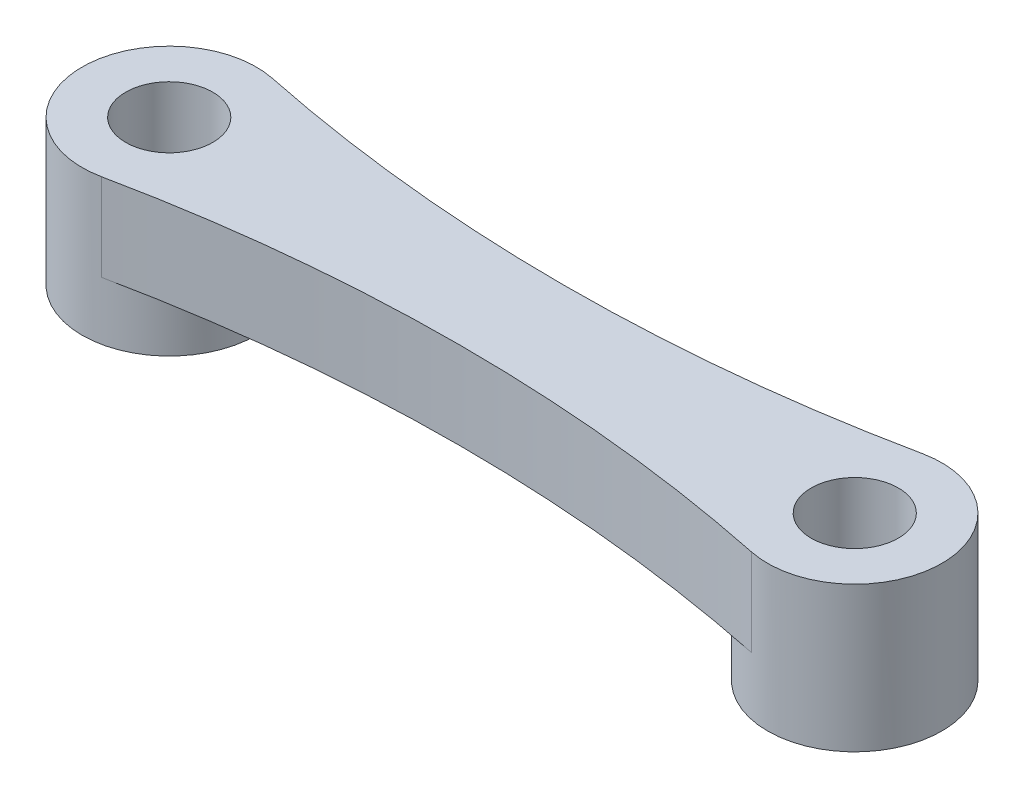
from build123d import *
from build123d.topology import SkipClean

# Parameters (mm, degrees)
SKETCH1_R           = 1.5
BOSS_EXTRUDE1_DEPTH = 3
SKETCH2_OUTSIDE_W   = 37.67
SKETCH2_OUTSIDE_H   = 14.07
CUT_EXTRUDE1_DEPTH  = 16.396103403
BOSS_EXTRUDE2_START = -3
SKETCH3_R           = 1.5
BOSS_EXTRUDE2_DEPTH = 2


with BuildPart() as part:
    # Sketch1 → Boss-Extrude1 (new body)
    with BuildSketch(Plane(origin=(0, 0, 0), x_dir=(1, 0, 0), z_dir=(0, 1, 0))):
        with BuildLine():
            Line((-11.8, 3), (11.8, 3))
            ThreePointArc((11.8, 3), (14.8, 0), (11.8, -3))
            Line((11.8, -3), (-11.8, -3))
            ThreePointArc((-11.8, -3), (-14.8, 0), (-11.8, 3))
        make_face()
        with Locations(Location((-11.8, 0, 0), (0, 0, 270))):
            Circle(SKETCH1_R, mode=Mode.SUBTRACT)
        with Locations(Location((11.8, 0, 0), (0, 0, 270))):
            Circle(SKETCH1_R, mode=Mode.SUBTRACT)
    extrude(amount=BOSS_EXTRUDE1_DEPTH)

    # Sketch2 outside → Cut-Extrude1 (cut, through all)
    with SkipClean():  # the faces are left unmerged after this step: merging them gives an invalid solid
        with BuildSketch(Plane(origin=(0, 3, 0), x_dir=(1, 0, 0), z_dir=(0, 1, 0))):
            Rectangle(SKETCH2_OUTSIDE_W, SKETCH2_OUTSIDE_H)
            with BuildLine():
                ThreePointArc((-11.189655172, 2.937257086), (-14.8, 0), (-11.189655172, -2.937257086))
                ThreePointArc((-11.189655172, -2.937257086), (0, -1.786970337), (11.189655172, -2.937257086))
                ThreePointArc((11.189655172, -2.937257086), (14.8, 0), (11.189655172, 2.937257086))
                ThreePointArc((11.189655172, 2.937257086), (0, 1.786970337), (-11.189655172, 2.937257086))
            make_face(mode=Mode.SUBTRACT)
        extrude(amount=-CUT_EXTRUDE1_DEPTH, mode=Mode.SUBTRACT)

    # Sketch3 → Boss-Extrude2 (add)
    # profile 1 of 2: a face of its own
    with SkipClean():  # the faces are left unmerged after this step: merging them gives an invalid solid
        with BuildSketch(Plane(origin=(0, 3, 0), x_dir=(1, 0, 0), z_dir=(0, 1, 0)).offset(BOSS_EXTRUDE2_START)):
            with BuildLine():
                ThreePointArc((-11.189655172, -2.937257086), (-9.472873609, -1.893273028), (-8.8, 0))
                ThreePointArc((-8.8, 0), (-9.472873609, 1.893273028), (-11.189655172, 2.937257086))
                ThreePointArc((-11.189655172, 2.937257086), (-14.8, 0), (-11.189655172, -2.937257086))
            make_face()
            with Locations(Location((-11.8, 0, 0), (0, 0, 270))):
                Circle(SKETCH3_R, mode=Mode.SUBTRACT)
        # profile 2 of 2: a face of its own
        with BuildSketch(Plane(origin=(0, 3, 0), x_dir=(1, 0, 0), z_dir=(0, 1, 0)).offset(BOSS_EXTRUDE2_START)):
            with BuildLine():
                ThreePointArc((11.189655172, -2.937257086), (13.693273028, -2.327126391), (14.8, 0))
                ThreePointArc((14.8, 0), (13.693273028, 2.327126391), (11.189655172, 2.937257086))
                ThreePointArc((11.189655172, 2.937257086), (8.8, 0), (11.189655172, -2.937257086))
            make_face()
            with Locations(Location((11.8, 0, 0), (0, 0, 270))):
                Circle(SKETCH3_R, mode=Mode.SUBTRACT)
        extrude(amount=-BOSS_EXTRUDE2_DEPTH)


solid = part.part
